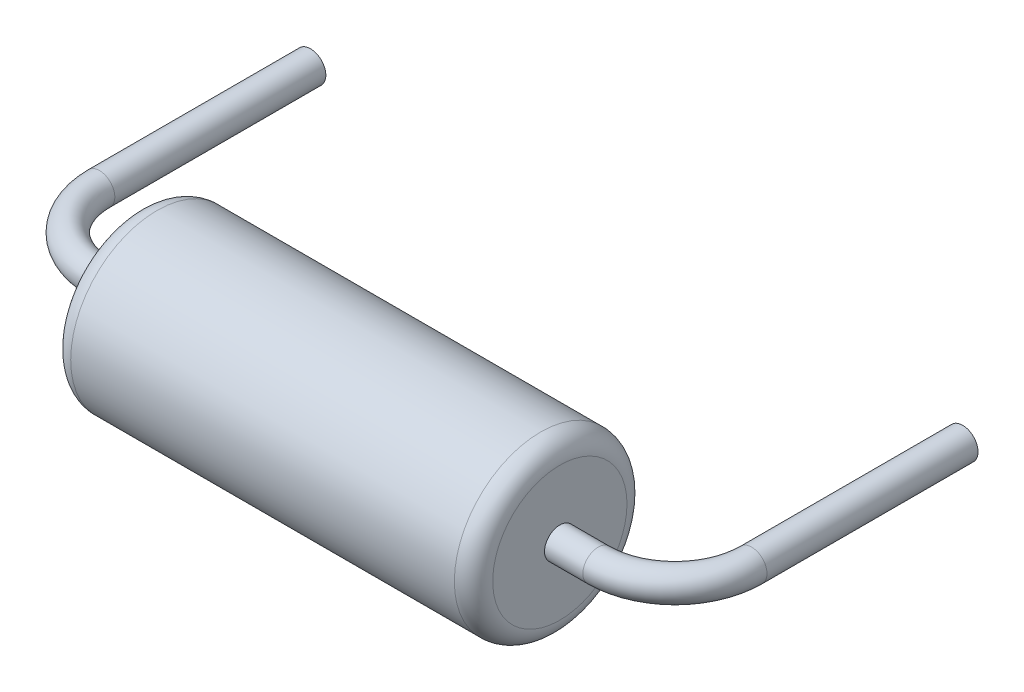
from build123d import *

# Parameters (mm, degrees)
SKETCH_3_R      = 2.25
EXTRUDE_1_DEPTH = 11
SKETCH_4_R      = 0.4
FILLET_1_R      = 0.5


with BuildPart() as part:
    # Эскиз3 → Вытянуть1 (new body)
    with BuildSketch(Plane(origin=(3, 0, 0), x_dir=(0, 0, -1), z_dir=(1, 0, 0))):
        with Locations((-2.25, 0)):
            Circle(SKETCH_3_R)
    extrude(amount=EXTRUDE_1_DEPTH)

    # По траектории1: sweep along a path in Эскиз5
    with BuildLine(Plane(origin=(0, 0, 0), x_dir=(1, 0, 0), z_dir=(0, 1, 0))) as sweep_1_path:
        Line((0, 5.25), (0, -0.25))
        ThreePointArc((0, -0.25), (0.585786438, -1.664213562), (2, -2.25))
        Line((2, -2.25), (2.965757317, -2.25))
        Line((2.965757317, -2.25), (14, -2.25))
        Line((14, -2.25), (15, -2.25))
        ThreePointArc((15, -2.25), (16.414213562, -1.664213562), (17, -0.25))
        Line((17, -0.25), (17, 0))
        Line((17, 0), (17, 5.250003271))
    # Эскиз4 → По траектории1 (sweep)
    with BuildSketch(Plane.XY.offset(-5.25)):
        Circle(SKETCH_4_R)
    sweep(path=sweep_1_path.line)

    # Скругление1
    fillet_1_edges = [part.edges().sort_by_distance(p)[0] for p in [
        (3, 0, 4.5),
        (14, 0, 4.5),
    ]]
    fillet(fillet_1_edges, radius=FILLET_1_R)


solid = part.part
